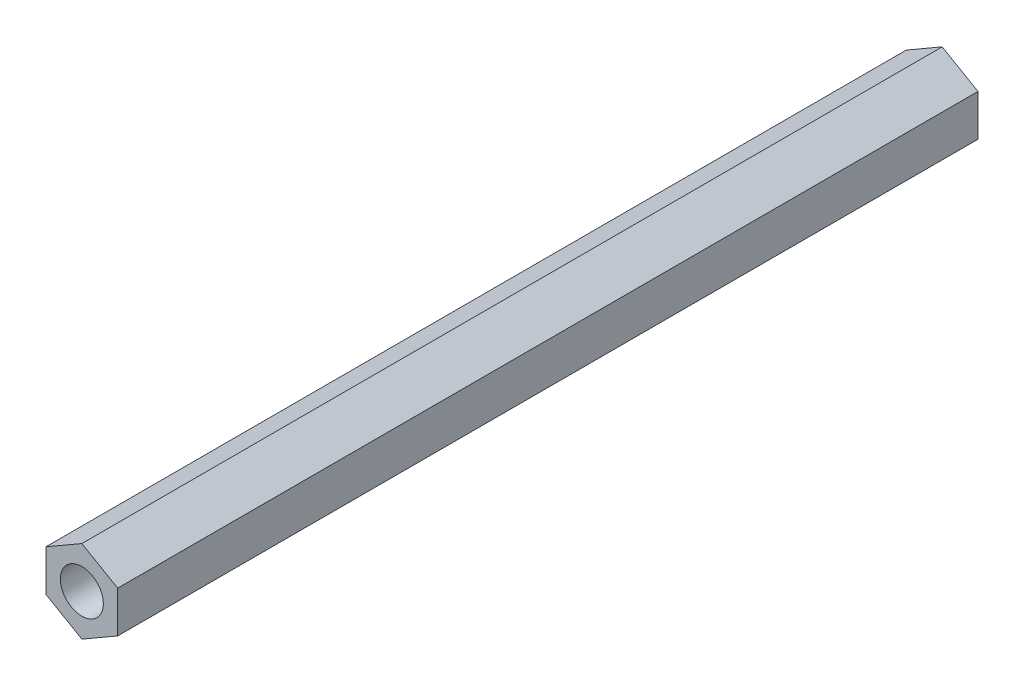
from build123d import *

# Parameters (mm, degrees)
SKETCH_1_R      = 1.5
EXTRUDE_1_DEPTH = 60


with BuildPart() as part:
    # 草图1 → 凸台-拉伸1 (new body)
    with BuildSketch(Plane.XY):
        Polygon((0, 2.886751346), (-2.5, 1.443375673), (-2.5, -1.443375673), (0, -2.886751346), (2.5, -1.443375673), (2.5, 1.443375673), align=None)
        Circle(SKETCH_1_R, mode=Mode.SUBTRACT)
    extrude(amount=EXTRUDE_1_DEPTH)


solid = part.part
